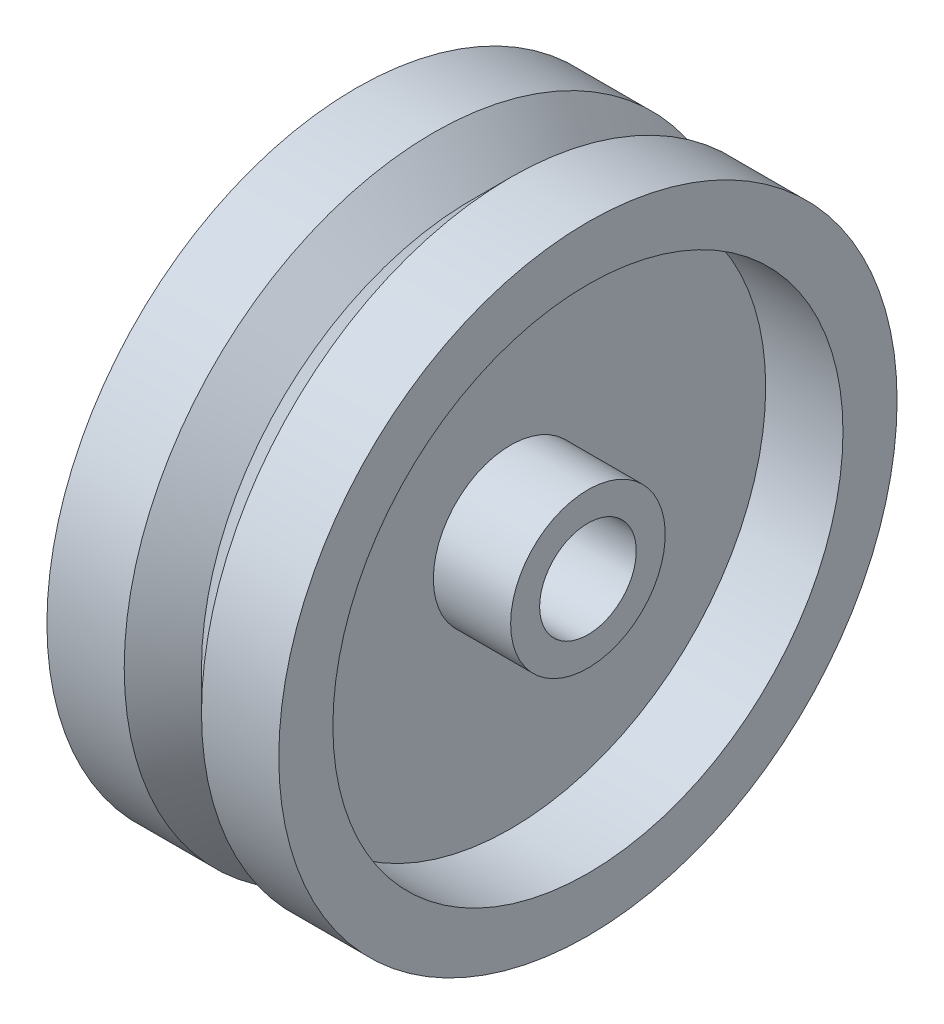
from build123d import *


with BuildPart() as part:
    # Sketch2 → Revolve2 (revolve)
    with BuildSketch(Plane.XY, mode=Mode.PRIVATE) as revolve2_sk:
        Polygon((-7.5, 3.125), (7.5, 3.125), (7.5, 5), (2.5, 5), (2.5, 16.5), (7.5, 16.5), (7.5, 20), (2.5, 20), (0, 17.5), (-2.5, 20), (-7.5, 20), (-7.5, 16.5), (-2.5, 16.5), (-2.5, 5), (-7.5, 5), align=None)
    revolve(revolve2_sk.sketch.rotate(Axis((-11.367190272, 0, 0), (1, 0, 0)), 90), axis=Axis((-11.367190272, 0, 0), (1, 0, 0)))


solid = part.part
